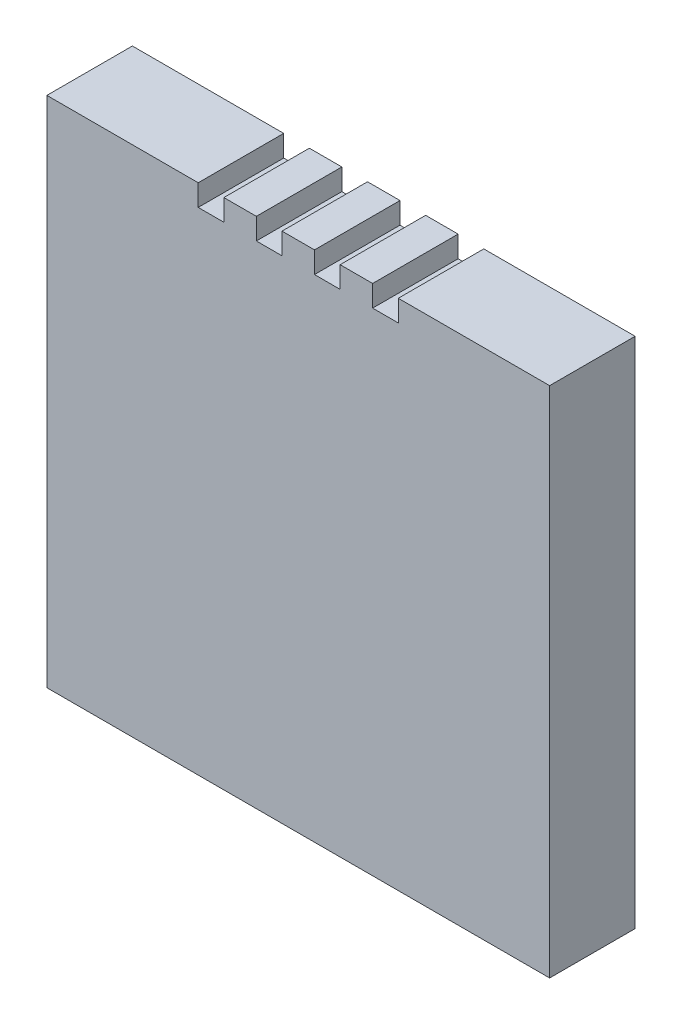
from build123d import *

# Parameters (mm, degrees)
SKETCH1_R               = 1.5
BOSS_EXTRUDE1_DEPTH     = 2
CUT_EXTRUDE2_DEPTH      = 17.07015868
CUT_EXTRUDE2_DEPTH_BACK = 17.07015868
SKETCH3_W               = 4.62
SKETCH3_H               = 2.672478053
SKETCH3_H_2             = 3.0633703


with BuildPart() as part:
    # Sketch1 → Boss-Extrude1 (new body)
    with BuildSketch(Plane.XY):
        Polygon((-10.5, -6), (10.5, -6), (10.5, 6), (2.34, 6), (2.34, 5.5), (1.74, 5.5), (1.74, 6), (0.98, 6), (0.98, 5.5), (0.38, 5.5), (0.38, 6), (-0.38, 6), (-0.38, 5.5), (-0.98, 5.5), (-0.98, 6), (-1.74, 6), (-1.74, 5.5), (-2.34, 5.5), (-2.34, 6), (-10.5, 6), align=None)
        with Locations((8.5, -2.5)):
            Circle(SKETCH1_R, mode=Mode.SUBTRACT)
        with Locations((-8.5, -2.5)):
            Circle(SKETCH1_R, mode=Mode.SUBTRACT)
    extrude(amount=BOSS_EXTRUDE1_DEPTH)

    # Sketch3 → Cut-Extrude2 (cut, two sides: drawn at the far end of the back side and taken through both)
    with BuildSketch(Plane(origin=(0, 6, 0), x_dir=(1, 0, 0), z_dir=(0, 1, 0)).offset(-CUT_EXTRUDE2_DEPTH_BACK)):
        with Locations((8.19, -1.336239027)):
            Rectangle(SKETCH3_W, SKETCH3_H)
        with Locations((-8.19, -1.53168515)):
            Rectangle(SKETCH3_W, SKETCH3_H_2)
    extrude(amount=CUT_EXTRUDE2_DEPTH + CUT_EXTRUDE2_DEPTH_BACK, mode=Mode.SUBTRACT)


solid = part.part
